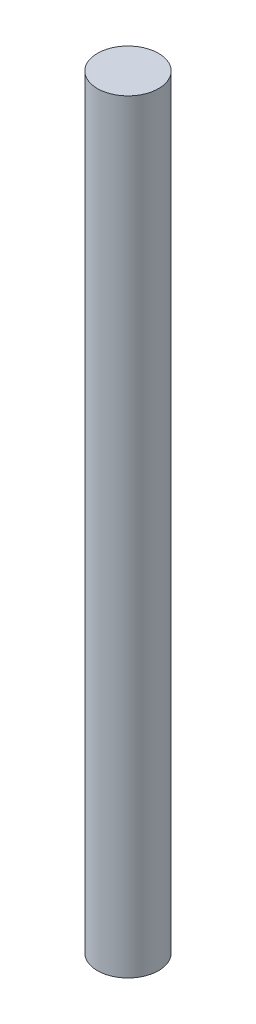
from build123d import *

# Parameters (mm, degrees)
SKETCH1_R           = 2.54
BOSS_EXTRUDE1_DEPTH = 63.5


with BuildPart() as part:
    # Sketch1 → Boss-Extrude1 (new body)
    with BuildSketch(Plane(origin=(0, 0, 0), x_dir=(1, 0, 0), z_dir=(0, 1, 0))):
        with Locations(Location((0, 0, 0), (0, 0, 270))):
            Circle(SKETCH1_R)
    extrude(amount=BOSS_EXTRUDE1_DEPTH)


solid = part.part
